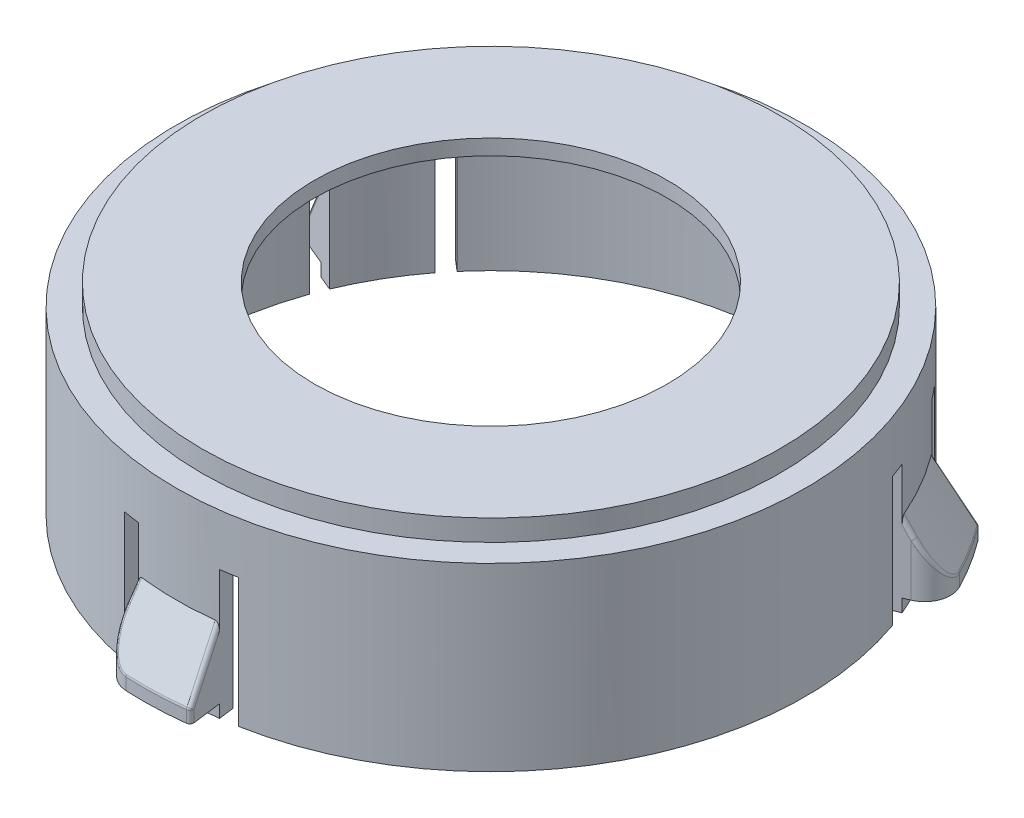
from build123d import *

# Parameters (mm, degrees)
SKETCH1_R                = 24.5
BOSS_EXTRUDE1_DEPTH      = 15.7
CUT_EXTRUDE1_START       = -1.65
SKETCH2_R                = 24.5
SKETCH2_R_2              = 22.5
CUT_EXTRUDE1_DEPTH       = 1.65
SHELL1_T                 = -1.2
SKETCH3_R                = 13.75
CUT_EXTRUDE2_DEPTH       = 1.2
FILLET2_R                = 2
FILLET3_R                = 0.3
CUT_EXTRUDE3_DEPTH       = 10.05
CIRPATTERN2_COUNT        = 3
FILLET2_OF_CIRPATTERN2_R = 2
FILLET3_OF_CIRPATTERN2_R = 0.3


with BuildPart() as part:
    # Sketch1 → Boss-Extrude1 (new body)
    with BuildSketch(Plane(origin=(0, 0, 0), x_dir=(1, 0, 0), z_dir=(0, 1, 0))):
        with Locations(Location((0, 0, 0), (0, 0, 270))):
            Circle(SKETCH1_R)
    extrude(amount=BOSS_EXTRUDE1_DEPTH)

    # Sketch2 → Cut-Extrude1 (cut)
    with BuildSketch(Plane(origin=(0, 15.7, 0), x_dir=(1, 0, 0), z_dir=(0, 1, 0)).offset(CUT_EXTRUDE1_START)):
        with Locations(Location((0, 0, 0), (0, 0, 270))):
            Circle(SKETCH2_R)
        with Locations(Location((0, 0, 0), (0, 0, 270))):
            Circle(SKETCH2_R_2, mode=Mode.SUBTRACT)
    extrude(amount=CUT_EXTRUDE1_DEPTH, mode=Mode.SUBTRACT)

    # Shell1
    shell1_openings = [part.faces().sort_by_distance(p)[0] for p in [
        (0, 0, 0),
    ]]
    offset(amount=SHELL1_T, openings=shell1_openings, kind=Kind.INTERSECTION)

    # Sketch3 → Cut-Extrude2 (cut)
    with BuildSketch(Plane(origin=(0, 15.7, 0), x_dir=(1, 0, 0), z_dir=(0, 1, 0))):
        with Locations(Location((0, 0, 0), (0, 0, 270))):
            Circle(SKETCH3_R)
    extrude(amount=-CUT_EXTRUDE2_DEPTH, mode=Mode.SUBTRACT)

    # Sweep1: sweep along a path in Sketch5
    with BuildLine(Plane(origin=(0, 1, 24.5), x_dir=(-1, 0, 0), z_dir=(0, -1, 0))) as sweep1_path:
        ThreePointArc((-3.5, -2.373034812), (0, -2.6), (3.5, -2.373034812))
    # Sketch4 → Sweep1 (sweep)
    with BuildSketch(Plane(origin=(0, 0, 0), x_dir=(0, 0, -1), z_dir=(1, 0, 0))):
        Polygon((-24.5, 6.5), (-24.5, 1), (-27.1, 1), (-27.1, 2), align=None)
    sweep1 = sweep(path=sweep1_path.line)

    # Fillet2
    fillet2_edges = [part.edges().sort_by_distance(p)[0] for p in [
        (-3.5, 1.5, 26.873034812),
    ]]
    fillet(fillet2_edges, radius=FILLET2_R)

    # Fillet3
    fillet3_edges = [part.edges().sort_by_distance(p)[0] for p in [
        (3.332103321, 4.25, 25.583922441),
        (3.5, 1.5, 26.873034812),
        (-3.197798366, 6.04983398, 24.552727664),
        (1.08054054, 2, 27.078449589),
        (-2.965542927, 3.450600451, 26.093900613),
    ]]
    fillet(fillet3_edges, radius=FILLET3_R)

    # Sketch7 → Cut-Extrude3 (cut)
    with BuildSketch(Plane.XZ):
        with BuildLine():
            Line((-3.009225092, 23.104860189), (-3.164206642, 24.29481007))
            ThreePointArc((-3.164206642, 24.29481007), (-3.799086335, 24.203655571), (-4.431362324, 24.095913097))
            Line((-4.431362324, 24.095913097), (-4.214316006, 22.915705108))
            ThreePointArc((-4.214316006, 22.915705108), (-3.613008637, 23.018170401), (-3.009225092, 23.104860189))
        make_face()
        with BuildLine():
            ThreePointArc((4.431362324, 24.095913097), (3.799086335, 24.203655571), (3.164206642, 24.29481007))
            Line((3.164206642, 24.29481007), (3.009225092, 23.104860189))
            ThreePointArc((3.009225092, 23.104860189), (3.613008637, 23.018170401), (4.214316006, 22.915705108))
            Line((4.214316006, 22.915705108), (4.431362324, 24.095913097))
        make_face()
    cut_extrude3 = extrude(amount=-CUT_EXTRUDE3_DEPTH, mode=Mode.SUBTRACT)

    # CirPattern2: Sweep1, Cut-Extrude3 ×3 about axis
    cirpattern2_axis = Axis((0, 14.05, 0), (0, 1, 0))
    add([sweep1.rotate(cirpattern2_axis, i * 360 / CIRPATTERN2_COUNT) for i in range(1, CIRPATTERN2_COUNT)])
    add([cut_extrude3.rotate(cirpattern2_axis, i * 360 / CIRPATTERN2_COUNT) for i in range(1, CIRPATTERN2_COUNT)], mode=Mode.SUBTRACT)

    # Fillet2 of CirPattern2
    fillet2_of_cirpattern2_edges = [part.edges().sort_by_distance(p)[0] for p in [
        (25.022730824, 1.5, -10.405428493),
        (-21.522730824, 1.5, -16.467606319),
    ]]
    fillet(fillet2_of_cirpattern2_edges, radius=FILLET2_OF_CIRPATTERN2_R)

    # Fillet3 of CirPattern2
    fillet3_of_cirpattern2_edges = [part.edges().sort_by_distance(p)[0] for p in [
        (20.490275102, 4.25, -15.677647344),
        (21.522730824, 1.5, -16.467606319),
        (22.862185072, 6.04983398, -9.50698921),
        (22.910354969, 2, -14.475000352),
        (24.080752278, 3.450600451, -10.478714795),
        (-23.822378423, 4.25, -9.906275096),
        (-25.022730824, 1.5, -10.405428493),
        (-19.664386706, 6.04983398, -15.045738453),
        (-23.990895509, 2, -12.603449237),
        (-21.115209351, 3.450600451, -15.615185817),
    ]]
    fillet(fillet3_of_cirpattern2_edges, radius=FILLET3_OF_CIRPATTERN2_R)


solid = part.part
